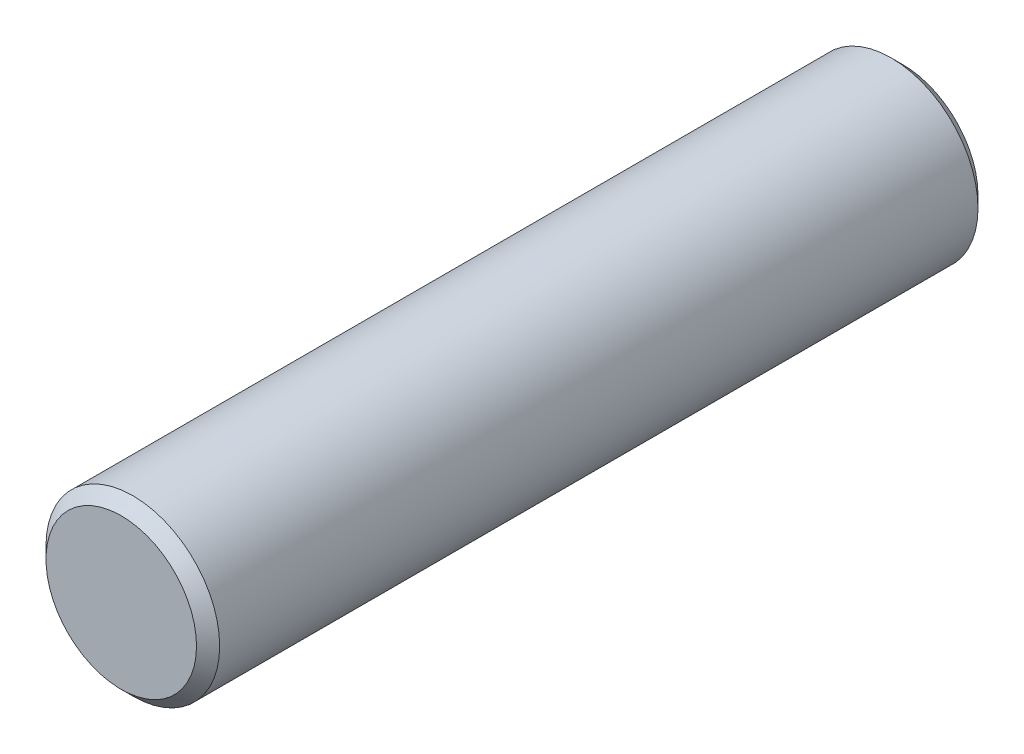
from build123d import *

# Parameters (mm, degrees)
SKETCH2_R           = 1.5
BOSS_EXTRUDE1_DEPTH = 13.5
CHAMFER1_SIZE       = 0.2


with BuildPart() as part:
    # Sketch2 → Boss-Extrude1 (new body)
    with BuildSketch(Plane.XY):
        Circle(SKETCH2_R)
    extrude(amount=BOSS_EXTRUDE1_DEPTH)

    # Chamfer1
    chamfer1_edges = [part.edges().sort_by_distance(p)[0] for p in [
        (-1.5, 0, 0),
        (-1.5, 0, 13.5),
    ]]
    chamfer(chamfer1_edges, length=CHAMFER1_SIZE)


solid = part.part
